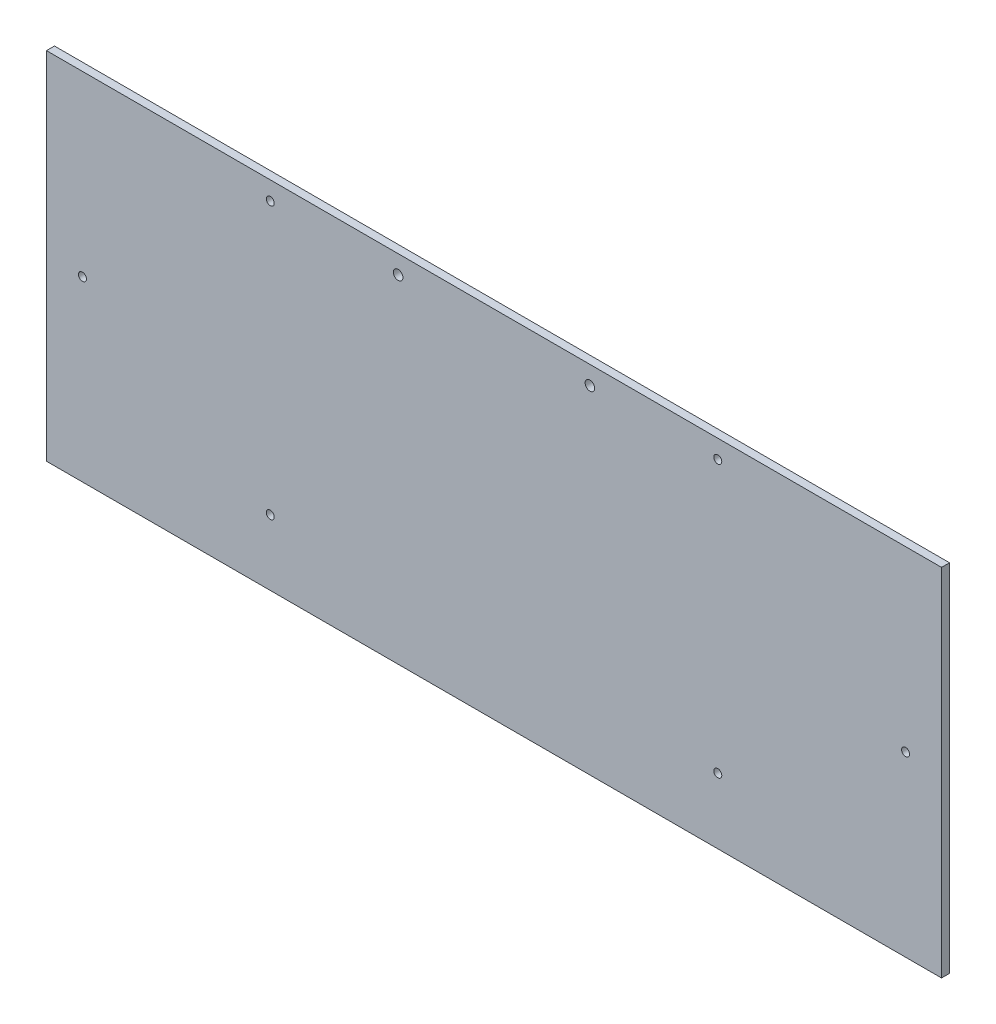
from build123d import *

# Parameters (mm, degrees)
SKETCH_1_W               = 560
SKETCH_1_H               = 222.5
EXTRUDE_1_DEPTH          = 5
CUT_EXTRUDE_3_DEPTH      = 358.674782449
CUT_EXTRUDE_3_DEPTH_BACK = 358.674782449
SKETCH_4_R               = 2.5
SKETCH_4_R_2             = 3


with BuildPart() as part:
    # 草图1 → 凸台-拉伸1 (new body)
    with BuildSketch(Plane.XY):
        with Locations((0, 111.25)):
            Rectangle(SKETCH_1_W, SKETCH_1_H)
    extrude(amount=EXTRUDE_1_DEPTH)

    # 草图4 → 切除-拉伸3 (cut, two sides: drawn at the far end of the back side and taken through both)
    with BuildSketch(Plane(origin=(0, 0, 0), x_dir=(-1, 0, 0), z_dir=(0, 0, -1)).offset(-CUT_EXTRUDE_3_DEPTH_BACK)):
        with Locations((-257.5, 111.25)):
            Circle(SKETCH_4_R)
        with Locations((-60, 211)):
            Circle(SKETCH_4_R_2)
        with Locations((-140, 211)):
            Circle(SKETCH_4_R)
        with Locations((-140, 41)):
            Circle(SKETCH_4_R)
        with Locations(Location((257.5, 111.25, 0), (0, 0, 180))):
            Circle(SKETCH_4_R)
        with Locations(Location((140, 211, 0), (0, 0, 180))):
            Circle(SKETCH_4_R)
        with Locations(Location((60, 211, 0), (0, 0, 180))):
            Circle(SKETCH_4_R_2)
        with Locations(Location((140, 41, 0), (0, 0, 180))):
            Circle(SKETCH_4_R)
    extrude(amount=CUT_EXTRUDE_3_DEPTH + CUT_EXTRUDE_3_DEPTH_BACK, mode=Mode.SUBTRACT)


solid = part.part
